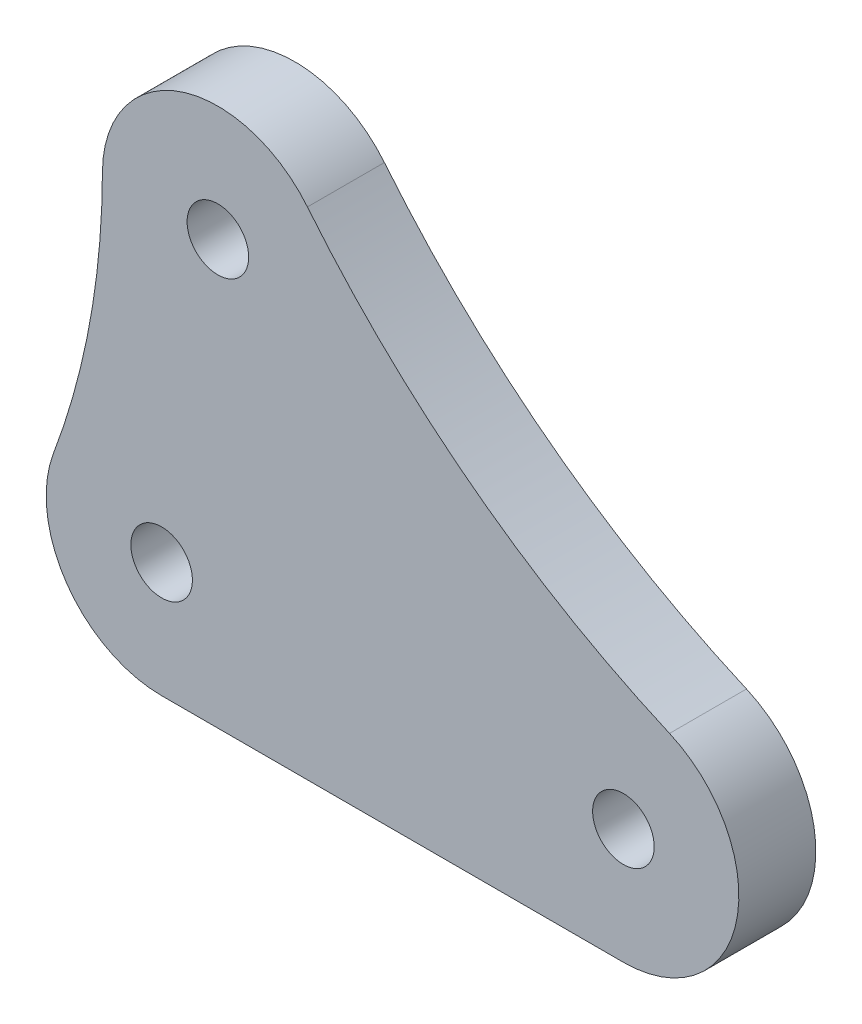
from build123d import *

# Parameters (mm, degrees)
SCHIZZO1_R                   = 2
ESTRUSIONE_ESTRUSIONE2_DEPTH = 5


with BuildPart() as part:
    # Schizzo1 → Estrusione-Estrusione2 (new body)
    with BuildSketch(Plane.XY):
        with BuildLine():
            Line((0, -7.5), (-30, -7.5))
            ThreePointArc((-30, -7.5), (-36.163671606, -4.273072938), (-37.023418224, 2.630892711))
            ThreePointArc((-37.023418224, 2.630892711), (-34.660163217, 11.185014243), (-33.846425364, 20.022197059))
            ThreePointArc((-33.846425364, 20.022197059), (-28.847620137, 27.070656902), (-20.528657412, 24.733201228))
            ThreePointArc((-20.528657412, 24.733201228), (-9.836766111, 14.395199143), (2.994965991, 6.87605837))
            ThreePointArc((2.994965991, 6.87605837), (7.342357856, -1.529634306), (0, -7.5))
        make_face()
        Circle(SCHIZZO1_R, mode=Mode.SUBTRACT)
        with Locations((-30, 0)):
            Circle(SCHIZZO1_R, mode=Mode.SUBTRACT)
        with Locations((-26.346458211, 20)):
            Circle(SCHIZZO1_R, mode=Mode.SUBTRACT)
    extrude(amount=ESTRUSIONE_ESTRUSIONE2_DEPTH)


solid = part.part
